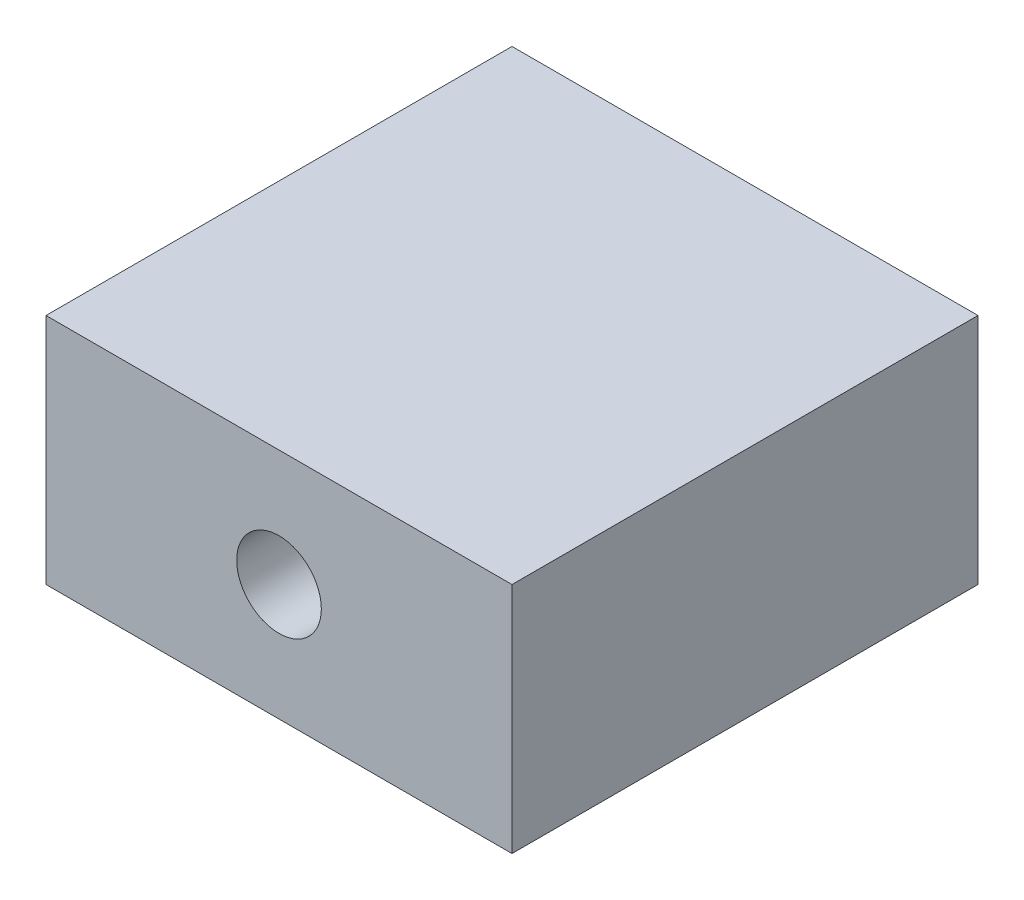
from build123d import *

# Parameters (mm, degrees)
SKETCH1_W           = 152.4
SKETCH1_H           = 76.2
BOSS_EXTRUDE1_DEPTH = 152.4
SKETCH2_R           = 13.843
CUT_EXTRUDE1_DEPTH  = 175.596133978


with BuildPart() as part:
    # Sketch1 → Boss-Extrude1 (new body)
    with BuildSketch(Plane.XY):
        Rectangle(SKETCH1_W, SKETCH1_H)
    extrude(amount=BOSS_EXTRUDE1_DEPTH)

    # Sketch2 → Cut-Extrude1 (cut, through all)
    with BuildSketch(Plane.XY):
        Circle(SKETCH2_R)
    extrude(amount=CUT_EXTRUDE1_DEPTH, mode=Mode.SUBTRACT)


solid = part.part
